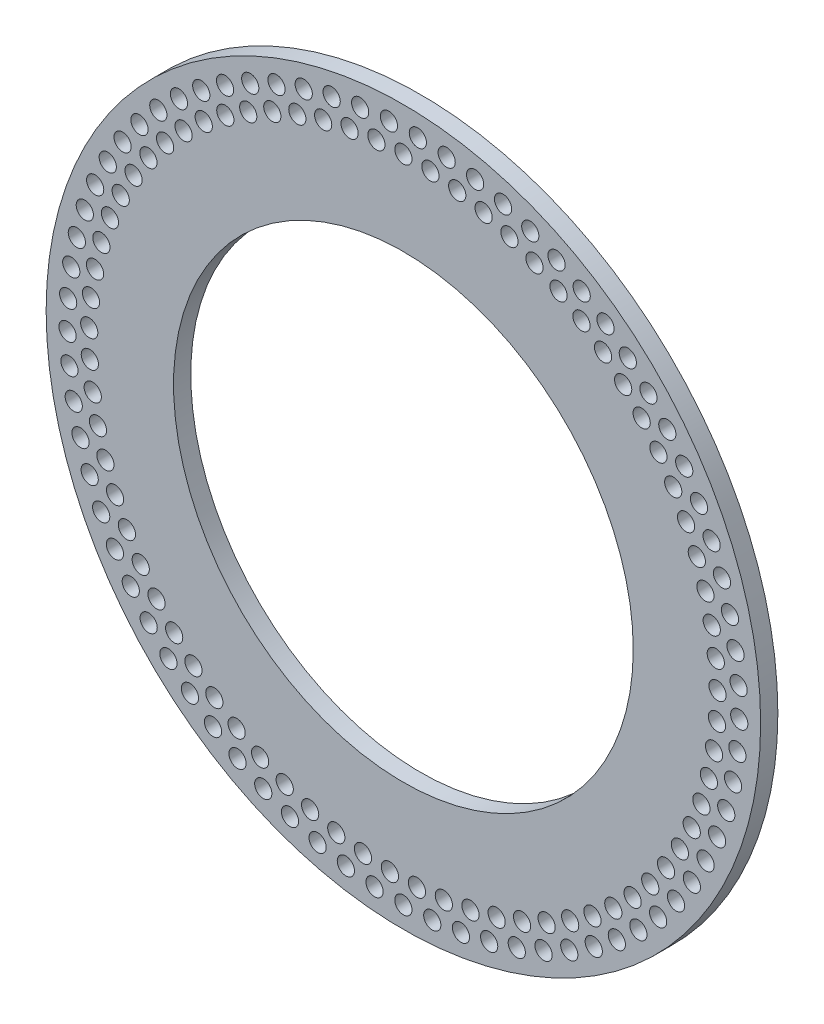
from build123d import *

# Parameters (mm, degrees)
IZIM1_R                     = 41.5
Y_KSEKLIK_EKSTR_ZYON1_DEPTH = 2
IZIM2_R                     = 26.7
KES_EKSTR_ZYON1_DEPTH       = 3
IZIM3_R                     = 1
KES_EKSTR_ZYON2_DEPTH       = 3


with BuildPart() as part:
    # Çizim1 → Yükseklik-Ekstrüzyon1 (new body)
    with BuildSketch(Plane.XY):
        Circle(IZIM1_R)
    extrude(amount=Y_KSEKLIK_EKSTR_ZYON1_DEPTH)

    # Çizim2 → Kes-Ekstrüzyon1 (cut)
    with BuildSketch(Plane.XY.offset(2)):
        Circle(IZIM2_R)
    extrude(amount=-KES_EKSTR_ZYON1_DEPTH, mode=Mode.SUBTRACT)

    # Çizim3 → Kes-Ekstrüzyon2 (cut)
    with BuildSketch(Plane(origin=(0, 0, 0), x_dir=(-1, 0, 0), z_dir=(0, 0, -1))):
        with Locations((0, 36.5)):
            Circle(IZIM3_R)
        with Locations((3.137715154, 36.364883385)):
            Circle(IZIM3_R)
        with Locations((6.252199763, 35.960533897)):
            Circle(IZIM3_R)
        with Locations((9.320395272, 35.289945197)):
            Circle(IZIM3_R)
        with Locations((12.319585835, 34.358082089)):
            Circle(IZIM3_R)
        with Locations((15.227566495, 33.171843763)):
            Circle(IZIM3_R)
        with Locations((18.022807581, 31.740012711)):
            Circle(IZIM3_R)
        with Locations((20.684614105, 30.07318971)):
            Circle(IZIM3_R)
        with Locations((23.193278982, 28.183715334)):
            Circle(IZIM3_R)
        with Locations((25.530228937, 26.085578591)):
            Circle(IZIM3_R)
        with Locations((27.678162009, 23.79431335)):
            Circle(IZIM3_R)
        with Locations((29.621175654, 21.326883337)):
            Circle(IZIM3_R)
        with Locations((31.344884477, 18.701556543)):
            Circle(IZIM3_R)
        with Locations((32.836526742, 15.937769966)):
            Circle(IZIM3_R)
        with Locations((34.085058852, 13.055985717)):
            Circle(IZIM3_R)
        with Locations((35.081237111, 10.077539518)):
            Circle(IZIM3_R)
        with Locations((35.817686165, 7.024482742)):
            Circle(IZIM3_R)
        with Locations((36.288953602, 3.919419153)):
            Circle(IZIM3_R)
        with Locations((36.491550322, 0.785337556)):
            Circle(IZIM3_R)
        with Locations((36.423976372, -2.354558405)):
            Circle(IZIM3_R)
        with Locations((36.086732043, -5.47702204)):
            Circle(IZIM3_R)
        with Locations((35.482314177, -8.558935719)):
            Circle(IZIM3_R)
        with Locations((34.61519767, -11.577482033)):
            Circle(IZIM3_R)
        with Locations((33.491802351, -14.510312721)):
            Circle(IZIM3_R)
        with Locations((32.120445445, -17.33571413)):
            Circle(IZIM3_R)
        with Locations((30.511279999, -20.032767977)):
            Circle(IZIM3_R)
        with Locations((28.67621971, -22.581506219)):
            Circle(IZIM3_R)
        with Locations((26.628850724, -24.963058889)):
            Circle(IZIM3_R)
        with Locations((24.384331044, -27.159793805)):
            Circle(IZIM3_R)
        with Locations((21.959278308, -29.15544711)):
            Circle(IZIM3_R)
        with Locations((19.371646758, -30.935243686)):
            Circle(IZIM3_R)
        with Locations((16.640594313, -32.48600654)):
            Circle(IZIM3_R)
        with Locations((13.78634073, -33.796254368)):
            Circle(IZIM3_R)
        with Locations((10.830017903, -34.856286552)):
            Circle(IZIM3_R)
        with Locations((7.793513414, -35.658254986)):
            Circle(IZIM3_R)
        with Locations((4.699308477, -36.196222176)):
            Circle(IZIM3_R)
        with Locations((1.570311505, -36.466205201)):
            Circle(IZIM3_R)
        with Locations((-1.570311505, -36.466205201)):
            Circle(IZIM3_R)
        with Locations((-4.699308477, -36.196222176)):
            Circle(IZIM3_R)
        with Locations((-7.793513414, -35.658254986)):
            Circle(IZIM3_R)
        with Locations((-10.830017903, -34.856286552)):
            Circle(IZIM3_R)
        with Locations((-13.78634073, -33.796254368)):
            Circle(IZIM3_R)
        with Locations((-16.640594313, -32.48600654)):
            Circle(IZIM3_R)
        with Locations((-19.371646758, -30.935243686)):
            Circle(IZIM3_R)
        with Locations((-21.959278308, -29.15544711)):
            Circle(IZIM3_R)
        with Locations((-24.384331044, -27.159793805)):
            Circle(IZIM3_R)
        with Locations((-26.628850724, -24.963058889)):
            Circle(IZIM3_R)
        with Locations((-28.67621971, -22.581506219)):
            Circle(IZIM3_R)
        with Locations((-30.511279999, -20.032767977)):
            Circle(IZIM3_R)
        with Locations((-32.120445445, -17.33571413)):
            Circle(IZIM3_R)
        with Locations((-33.491802351, -14.510312721)):
            Circle(IZIM3_R)
        with Locations((-34.61519767, -11.577482033)):
            Circle(IZIM3_R)
        with Locations((-35.482314177, -8.558935719)):
            Circle(IZIM3_R)
        with Locations((-36.086732043, -5.47702204)):
            Circle(IZIM3_R)
        with Locations((-36.423976372, -2.354558405)):
            Circle(IZIM3_R)
        with Locations((-36.491550322, 0.785337556)):
            Circle(IZIM3_R)
        with Locations((-36.288953602, 3.919419153)):
            Circle(IZIM3_R)
        with Locations((-35.817686165, 7.024482742)):
            Circle(IZIM3_R)
        with Locations((-35.081237111, 10.077539518)):
            Circle(IZIM3_R)
        with Locations((-34.085058852, 13.055985717)):
            Circle(IZIM3_R)
        with Locations((-32.836526742, 15.937769966)):
            Circle(IZIM3_R)
        with Locations((-31.344884477, 18.701556543)):
            Circle(IZIM3_R)
        with Locations((-29.621175654, 21.326883337)):
            Circle(IZIM3_R)
        with Locations((-27.678162009, 23.79431335)):
            Circle(IZIM3_R)
        with Locations((-25.530228937, 26.085578591)):
            Circle(IZIM3_R)
        with Locations((-23.193278982, 28.183715334)):
            Circle(IZIM3_R)
        with Locations((-20.684614105, 30.07318971)):
            Circle(IZIM3_R)
        with Locations((-18.022807581, 31.740012711)):
            Circle(IZIM3_R)
        with Locations((-15.227566495, 33.171843763)):
            Circle(IZIM3_R)
        with Locations((-12.319585835, 34.358082089)):
            Circle(IZIM3_R)
        with Locations((-9.320395272, 35.289945197)):
            Circle(IZIM3_R)
        with Locations((-6.252199763, 35.960533897)):
            Circle(IZIM3_R)
        with Locations((-3.137715154, 36.364883385)):
            Circle(IZIM3_R)
        with Locations((-1.6788307, 38.986267781)):
            Circle(IZIM3_R)
        with Locations((1.6788307, 38.986267781)):
            Circle(IZIM3_R)
        with Locations((5.024062626, 38.697627095)):
            Circle(IZIM3_R)
        with Locations((8.33209815, 38.122482716)):
            Circle(IZIM3_R)
        with Locations((11.578445734, 37.265092813)):
            Circle(IZIM3_R)
        with Locations((14.739070557, 36.131805202)):
            Circle(IZIM3_R)
        with Locations((17.790572459, 34.731010345)):
            Circle(IZIM3_R)
        with Locations((20.710359186, 33.07307924)):
            Circle(IZIM3_R)
        with Locations((23.47681366, 31.170286627)):
            Circle(IZIM3_R)
        with Locations((26.069454019, 29.036720117)):
            Circle(IZIM3_R)
        with Locations((28.469085261, 26.688175891)):
            Circle(IZIM3_R)
        with Locations((30.657941357, 24.142041748)):
            Circle(IZIM3_R)
        with Locations((32.619816781, 21.417168374)):
            Circle(IZIM3_R)
        with Locations((34.340186495, 18.533729779)):
            Circle(IZIM3_R)
        with Locations((35.806313482, 15.513073933)):
            Circle(IZIM3_R)
        with Locations((37.007343052, 12.377564715)):
            Circle(IZIM3_R)
        with Locations((37.934383201, 9.150416338)):
            Circle(IZIM3_R)
        with Locations((38.580570449, 5.855521481)):
            Circle(IZIM3_R)
        with Locations((38.941120652, 2.517274391)):
            Circle(IZIM3_R)
        with Locations((39.013364422, -0.839609718)):
            Circle(IZIM3_R)
        with Locations((38.796766891, -4.190277651)):
            Circle(IZIM3_R)
        with Locations((38.292931672, -7.509922233)):
            Circle(IZIM3_R)
        with Locations((37.505588985, -10.773965979)):
            Circle(IZIM3_R)
        with Locations((36.440568038, -13.95824305)):
            Circle(IZIM3_R)
        with Locations((35.105753876, -17.039178174)):
            Circle(IZIM3_R)
        with Locations((33.511028994, -19.993961183)):
            Circle(IZIM3_R)
        with Locations((31.668200178, -22.8007159)):
            Circle(IZIM3_R)
        with Locations((29.590911087, -25.438662093)):
            Circle(IZIM3_R)
        with Locations((27.294541244, -27.888269332)):
            Circle(IZIM3_R)
        with Locations((24.796092167, -30.131401582)):
            Circle(IZIM3_R)
        with Locations((22.114061498, -32.151451477)):
            Circle(IZIM3_R)
        with Locations((19.268306056, -33.933463274)):
            Circle(IZIM3_R)
        with Locations((16.279894817, -35.464243581)):
            Circle(IZIM3_R)
        with Locations((13.170952932, -36.732459037)):
            Circle(IZIM3_R)
        with Locations((9.96449792, -37.728720217)):
            Circle(IZIM3_R)
        with Locations((6.684269252, -38.445651153)):
            Circle(IZIM3_R)
        with Locations((3.354552593, -38.877943939)):
            Circle(IZIM3_R)
        with Locations((0, -39.02239803)):
            Circle(IZIM3_R)
        with Locations((-3.354552593, -38.877943939)):
            Circle(IZIM3_R)
        with Locations((-6.684269252, -38.445651153)):
            Circle(IZIM3_R)
        with Locations((-9.96449792, -37.728720217)):
            Circle(IZIM3_R)
        with Locations((-13.170952932, -36.732459037)):
            Circle(IZIM3_R)
        with Locations((-16.279894817, -35.464243581)):
            Circle(IZIM3_R)
        with Locations((-19.268306056, -33.933463274)):
            Circle(IZIM3_R)
        with Locations((-22.114061498, -32.151451477)):
            Circle(IZIM3_R)
        with Locations((-24.796092167, -30.131401582)):
            Circle(IZIM3_R)
        with Locations((-27.294541244, -27.888269332)):
            Circle(IZIM3_R)
        with Locations((-29.590911087, -25.438662093)):
            Circle(IZIM3_R)
        with Locations((-31.668200178, -22.8007159)):
            Circle(IZIM3_R)
        with Locations((-33.511028994, -19.993961183)):
            Circle(IZIM3_R)
        with Locations((-35.105753876, -17.039178174)):
            Circle(IZIM3_R)
        with Locations((-36.440568038, -13.95824305)):
            Circle(IZIM3_R)
        with Locations((-37.505588985, -10.773965979)):
            Circle(IZIM3_R)
        with Locations((-38.292931672, -7.509922233)):
            Circle(IZIM3_R)
        with Locations((-38.796766891, -4.190277651)):
            Circle(IZIM3_R)
        with Locations((-39.013364422, -0.839609718)):
            Circle(IZIM3_R)
        with Locations((-38.941120652, 2.517274391)):
            Circle(IZIM3_R)
        with Locations((-38.580570449, 5.855521481)):
            Circle(IZIM3_R)
        with Locations((-37.934383201, 9.150416338)):
            Circle(IZIM3_R)
        with Locations((-37.007343052, 12.377564715)):
            Circle(IZIM3_R)
        with Locations((-35.806313482, 15.513073933)):
            Circle(IZIM3_R)
        with Locations((-34.340186495, 18.533729779)):
            Circle(IZIM3_R)
        with Locations((-32.619816781, 21.417168374)):
            Circle(IZIM3_R)
        with Locations((-30.657941357, 24.142041748)):
            Circle(IZIM3_R)
        with Locations((-28.469085261, 26.688175891)):
            Circle(IZIM3_R)
        with Locations((-26.069454019, 29.036720117)):
            Circle(IZIM3_R)
        with Locations((-23.47681366, 31.170286627)):
            Circle(IZIM3_R)
        with Locations((-20.710359186, 33.07307924)):
            Circle(IZIM3_R)
        with Locations((-17.790572459, 34.731010345)):
            Circle(IZIM3_R)
        with Locations((-14.739070557, 36.131805202)):
            Circle(IZIM3_R)
        with Locations((-11.578445734, 37.265092813)):
            Circle(IZIM3_R)
        with Locations((-8.33209815, 38.122482716)):
            Circle(IZIM3_R)
        with Locations((-5.024062626, 38.697627095)):
            Circle(IZIM3_R)
    extrude(amount=-KES_EKSTR_ZYON2_DEPTH, mode=Mode.SUBTRACT)


solid = part.part
